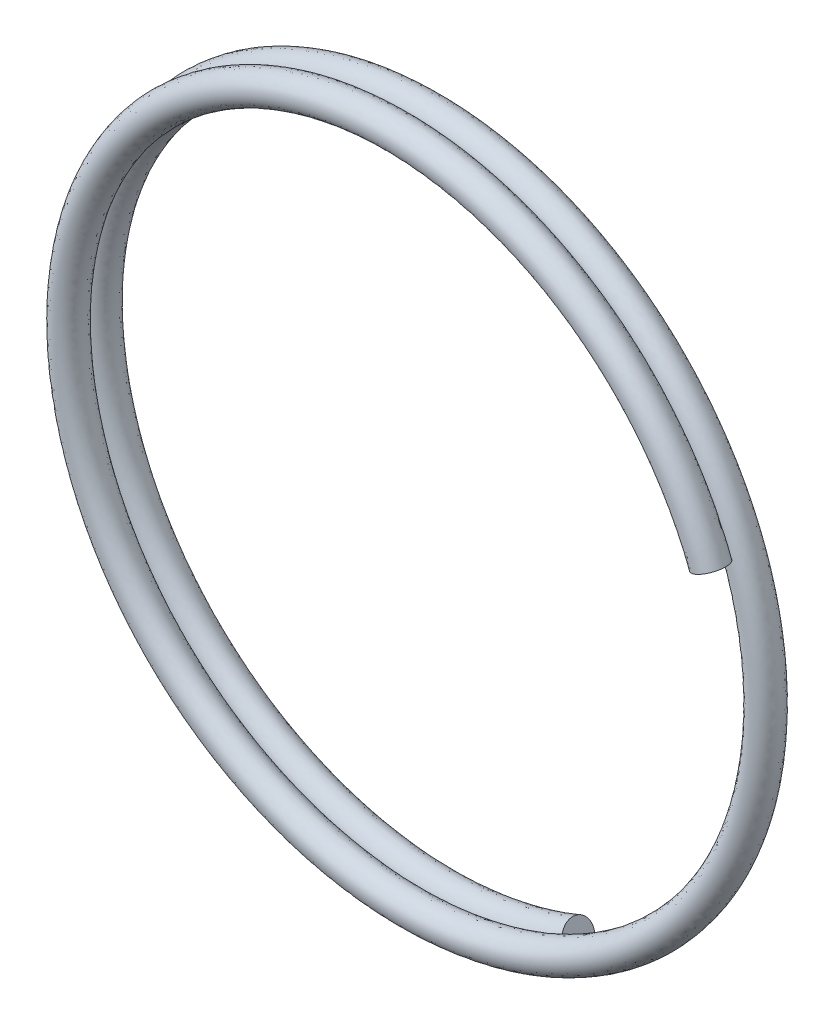
from build123d import *

# Parameters (mm, degrees)
SWEEP1_PITCH       = 1.028571429
SWEEP1_HEIGHT      = 1.8
SWEEP1_RADIUS      = 11
SWEEP1_START_ANGLE = 158
SKETCH2_R          = 0.5


with BuildPart() as part:
    # Sweep1: sweep along a helix
    with BuildLine() as sweep1_path:
        add(Helix(SWEEP1_PITCH, SWEEP1_HEIGHT, SWEEP1_RADIUS, center=(0, 0, 0), direction=(0, 0, -1), lefthand=True, mode=Mode.PRIVATE).rotate(Axis((0, 0, 0), (0, 0, -1)), SWEEP1_START_ANGLE))
    # Sketch2 → Sweep1 (sweep)
    with BuildSketch(Plane(origin=(4.120672528, -10.1990224, -1.8), x_dir=(-0.3737601638682698, 0.9266705240078769, 0.03981306117508324), z_dir=(0.9270811978101128, 0.37456511739398257, -0.014880372932110052))):
        with Locations((0.014717515, -0.007132469)):
            Circle(SKETCH2_R)
    sweep(path=sweep1_path.line, is_frenet=True)


solid = part.part
